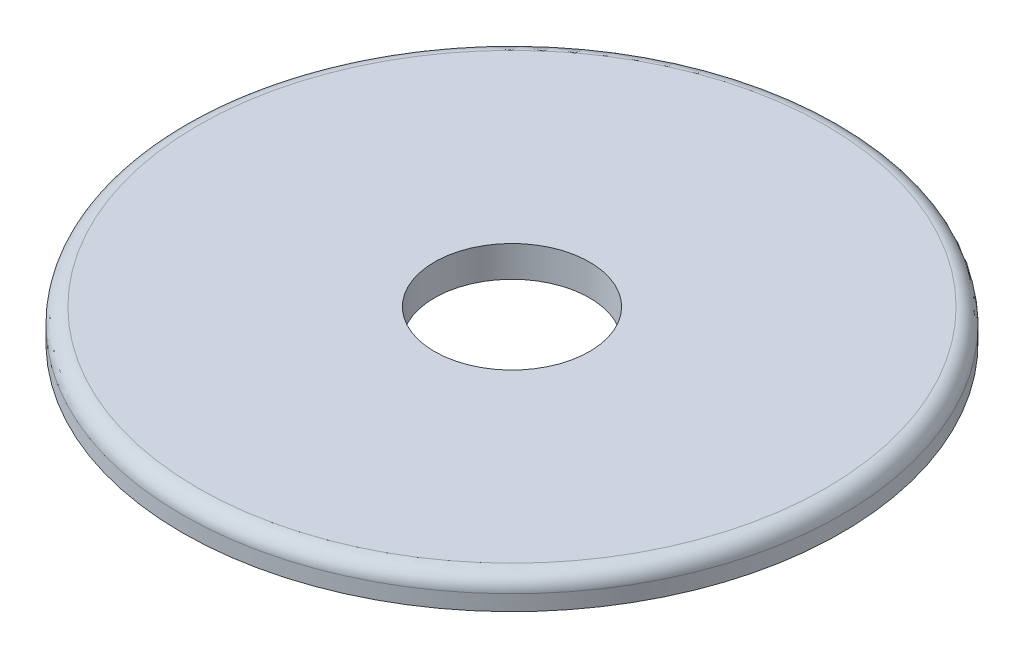
from build123d import *

# Parameters (mm, degrees)
SKETCH1_R           = 21.25
SKETCH1_R_2         = 5
BOSS_EXTRUDE1_DEPTH = 2
FILLET1_R           = 1


with BuildPart() as part:
    # Sketch1 → Boss-Extrude1 (new body)
    with BuildSketch(Plane(origin=(0, 0, 0), x_dir=(1, 0, 0), z_dir=(0, 1, 0))):
        with Locations(Location((0, 0, 0), (0, 0, 270))):
            Circle(SKETCH1_R)
        with Locations(Location((0, 0, 0), (0, 0, 270))):
            Circle(SKETCH1_R_2, mode=Mode.SUBTRACT)
    extrude(amount=BOSS_EXTRUDE1_DEPTH)

    # Fillet1
    fillet1_edges = [part.edges().sort_by_distance(p)[0] for p in [
        (0, 2, -21.25),
    ]]
    fillet(fillet1_edges, radius=FILLET1_R)


solid = part.part
